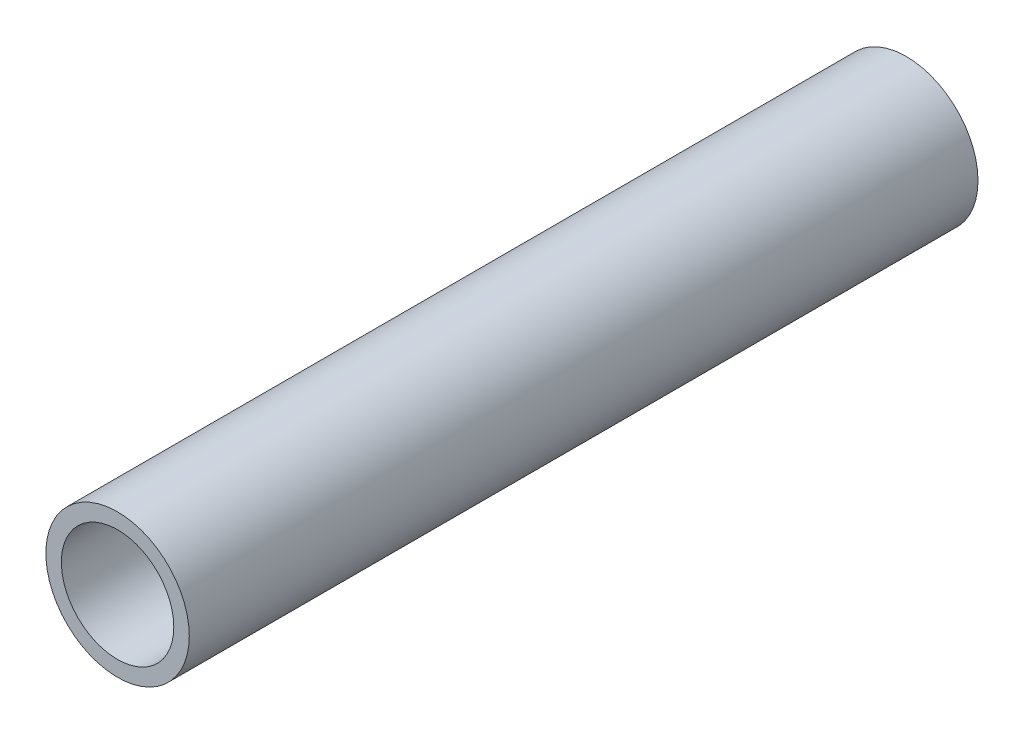
from build123d import *

# Parameters (mm, degrees)
SKETCH1_R           = 3.175
SKETCH1_R_2         = 2.4892
BOSS_EXTRUDE1_DEPTH = 34.925


with BuildPart() as part:
    # Sketch1 → Boss-Extrude1 (new body)
    with BuildSketch(Plane.XY):
        Circle(SKETCH1_R)
        Circle(SKETCH1_R_2, mode=Mode.SUBTRACT)
    extrude(amount=BOSS_EXTRUDE1_DEPTH)


solid = part.part
